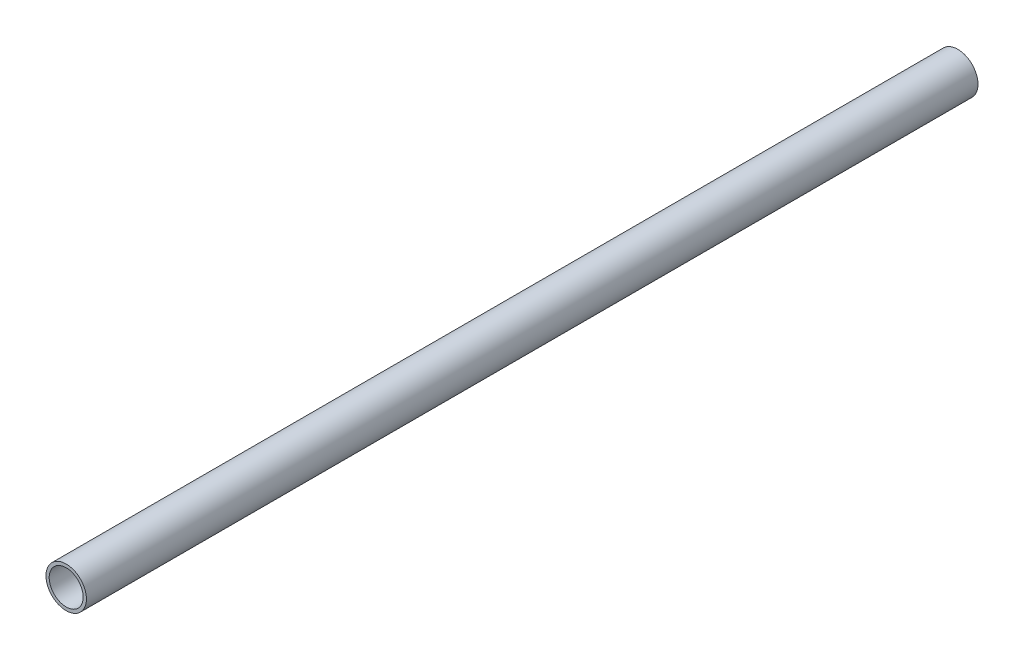
from build123d import *

# Parameters (mm, degrees)
SKETCH1_R           = 3.175
SKETCH1_R_2         = 2.667
BOSS_EXTRUDE1_DEPTH = 140


with BuildPart() as part:
    # Sketch1 → Boss-Extrude1 (new body)
    with BuildSketch(Plane.XY):
        Circle(SKETCH1_R)
        Circle(SKETCH1_R_2, mode=Mode.SUBTRACT)
    extrude(amount=BOSS_EXTRUDE1_DEPTH)


solid = part.part
